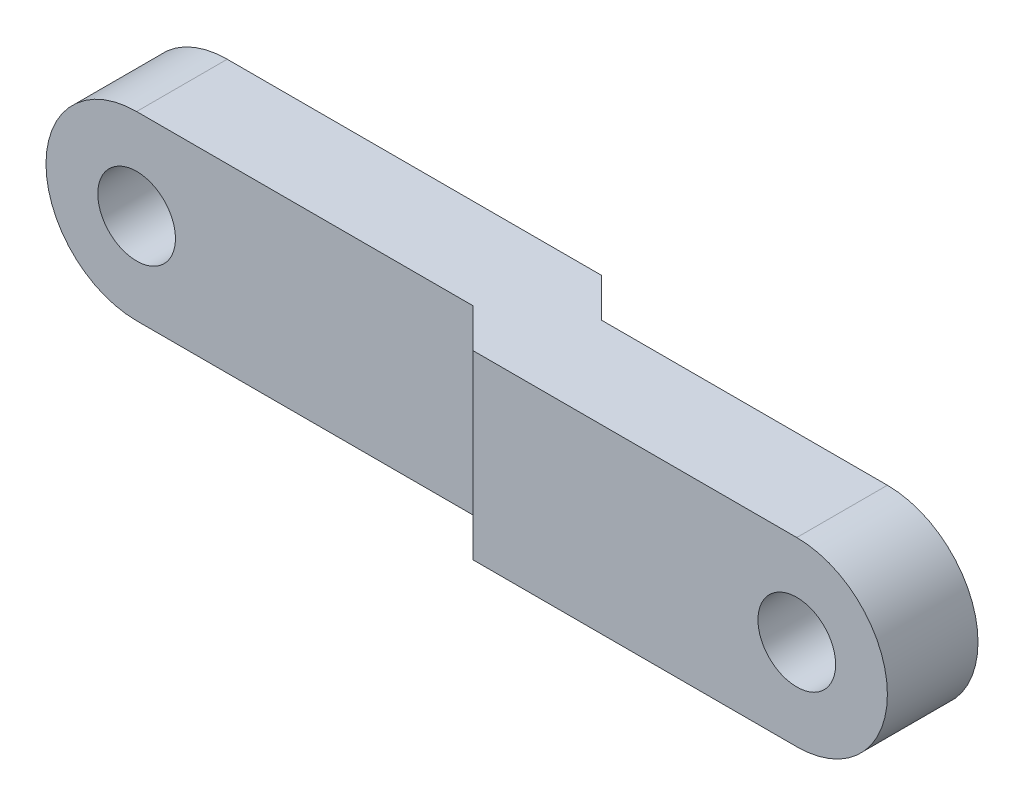
from build123d import *

# Parameters (mm, degrees)
SKETCH1_R           = 1.5
BOSS_EXTRUDE1_DEPTH = 5
SKETCH2_W           = 3.5
SKETCH2_H           = 1.5
CUT_EXTRUDE1_DEPTH  = 32.689903755


with BuildPart() as part:
    # Sketch1 → Boss-Extrude1 (new body)
    with BuildSketch(Plane.XY):
        with BuildLine():
            Line((0, 0), (27, 0))
            ThreePointArc((27, 0), (30.5, -3.5), (27, -7))
            Line((27, -7), (0, -7))
            ThreePointArc((0, -7), (-3.5, -3.5), (0, 0))
        make_face()
        with Locations((0, -3.5)):
            Circle(SKETCH1_R, mode=Mode.SUBTRACT)
        with Locations((27, -3.5)):
            Circle(SKETCH1_R, mode=Mode.SUBTRACT)
    extrude(amount=BOSS_EXTRUDE1_DEPTH)

    # Sketch2 → Cut-Extrude1 (cut, through all)
    with BuildSketch(Plane(origin=(0, 0, 0), x_dir=(1, 0, 0), z_dir=(0, 1, 0))):
        Polygon((0, -5), (14.5, -5), (13, -3.5), (0, -3.5), align=None)
        Polygon((15.949747468, -1.5), (27, -1.5), (27, 0), (14.449747468, 0), align=None)
        with Locations((-1.75, -4.25)):
            Rectangle(SKETCH2_W, SKETCH2_H)
        with Locations((28.75, -0.75)):
            Rectangle(SKETCH2_W, SKETCH2_H)
    extrude(amount=-CUT_EXTRUDE1_DEPTH, mode=Mode.SUBTRACT)


solid = part.part
